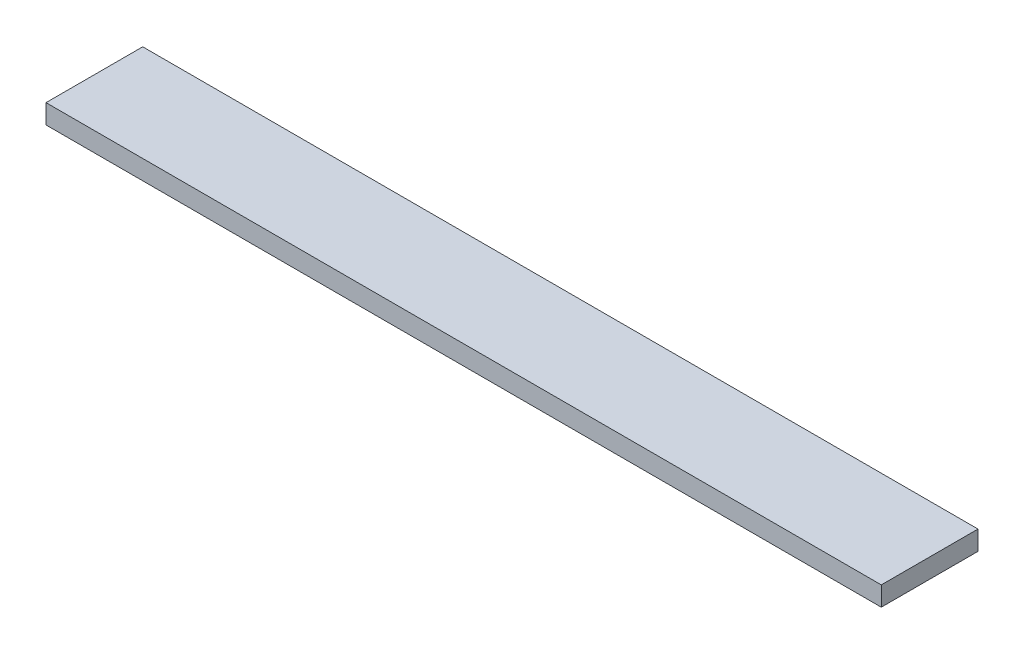
from build123d import *

# Parameters (mm, degrees)
SKETCH1_W           = 215.9
SKETCH1_H           = 5
BOSS_EXTRUDE1_DEPTH = 25


with BuildPart() as part:
    # Sketch1 → Boss-Extrude1 (new body)
    with BuildSketch(Plane.XY):
        with Locations((-107.95, -2.5)):
            Rectangle(SKETCH1_W, SKETCH1_H)
    extrude(amount=BOSS_EXTRUDE1_DEPTH)


solid = part.part
